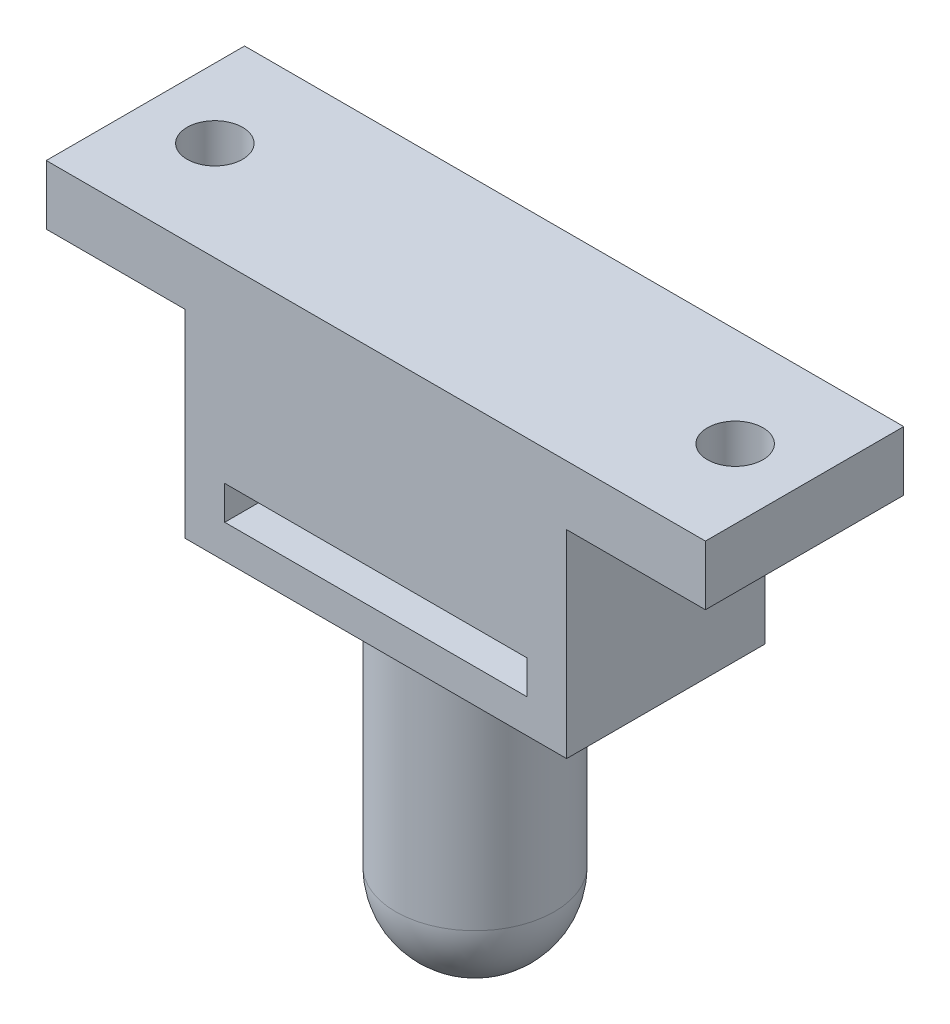
from build123d import *

# Parameters (mm, degrees)
SKETCH1_W             = 7
SKETCH1_H             = 10
BOSS_EXTRUDE1_DEPTH   = 3
BOSS_EXTRUDE1_2_DEPTH = 3
SKETCH1_4_W           = 19.24
SKETCH1_4_H           = 10
BOSS_EXTRUDE2_DEPTH   = 13
SKETCH2_W             = 15.24
SKETCH2_H             = 1.7
CUT_EXTRUDE1_DEPTH    = 14
SKETCH3_R             = 4
BOSS_EXTRUDE3_DEPTH   = 16
FILLET1_R             = 4
CUT_EXTRUDE2_REACH    = 35.797
SKETCH4_R             = 1.4
CUT_EXTRUDE3_REACH    = 37.797
CUT_EXTRUDE3_START    = -2
SKETCH4_3_R           = 1.4


with BuildPart() as part:
    # Sketch1 → Boss-Extrude1 (new body)
    with BuildSketch(Plane(origin=(0, 0, 0), x_dir=(1, 0, 0), z_dir=(0, 1, 0))):
        with Locations((-13.12, 0)):
            Rectangle(SKETCH1_W, SKETCH1_H)
    extrude(amount=-BOSS_EXTRUDE1_DEPTH)



with BuildPart() as body_2:
    # Sketch1 → Boss-Extrude1 2 (new body)
    with BuildSketch(Plane(origin=(0, 0, 0), x_dir=(1, 0, 0), z_dir=(0, 1, 0))):
        with Locations((13.12, 0)):
            Rectangle(SKETCH1_W, SKETCH1_H)
    extrude(amount=-BOSS_EXTRUDE1_2_DEPTH)


with BuildPart() as part_1:
    add(part.part)

    add(body_2.part)  # Boss-Extrude2 merges body 2
    # Sketch1<4> → Boss-Extrude2 (add)
    with BuildSketch(Plane(origin=(0, 0, 0), x_dir=(1, 0, 0), z_dir=(0, 1, 0))):
        Rectangle(SKETCH1_4_W, SKETCH1_4_H)
    extrude(amount=-BOSS_EXTRUDE2_DEPTH)

    # Sketch2 → Cut-Extrude1 (cut)
    with BuildSketch(Plane.XY.offset(5)):
        with Locations((0, -10.45)):
            Rectangle(SKETCH2_W, SKETCH2_H)
    extrude(amount=-CUT_EXTRUDE1_DEPTH, mode=Mode.SUBTRACT)

    # Sketch3 → Boss-Extrude3 (add)
    with BuildSketch(Plane.XZ.offset(13)):
        Circle(SKETCH3_R)
    extrude(amount=BOSS_EXTRUDE3_DEPTH)

    # Fillet1
    fillet1_edges = [part_1.edges().sort_by_distance(p)[0] for p in [
        (-4, -29, 0),
    ]]
    fillet(fillet1_edges, radius=FILLET1_R)

    # Sketch4 → Cut-Extrude2 (cut, up to next)
    with BuildSketch(Plane(origin=(0, 0, 0), x_dir=(1, 0, 0), z_dir=(0, 1, 0)), mode=Mode.PRIVATE) as cut_extrude2_sk1:
        with Locations((-13.12, 0)):
            Circle(SKETCH4_R)
    cut_extrude2_tool1 = extrude(cut_extrude2_sk1.sketch, amount=-CUT_EXTRUDE2_REACH, mode=Mode.PRIVATE) & part_1.part
    # Sketch4 → Cut-Extrude2 (cut, up to next)
    with BuildSketch(Plane(origin=(0, 0, 0), x_dir=(1, 0, 0), z_dir=(0, 1, 0)), mode=Mode.PRIVATE) as cut_extrude2_sk2:
        with Locations((13.12, 0)):
            Circle(SKETCH4_R)
    cut_extrude2_tool2 = extrude(cut_extrude2_sk2.sketch, amount=-CUT_EXTRUDE2_REACH, mode=Mode.PRIVATE) & part_1.part
    add(cut_extrude2_tool1.solids().sort_by_distance((-13.12, 0, 0))[0], mode=Mode.SUBTRACT)
    add(cut_extrude2_tool2.solids().sort_by_distance((13.12, 0, 0))[0], mode=Mode.SUBTRACT)

    # Sketch4<3> → Cut-Extrude3 (cut, up to next)
    with BuildSketch(Plane(origin=(0, 0, 0), x_dir=(1, 0, 0), z_dir=(0, 1, 0)).offset(CUT_EXTRUDE3_START), mode=Mode.PRIVATE) as cut_extrude3_sk1:
        Polygon((-15.62, 1.443375673), (-15.62, -1.443375673), (-13.12, -2.886751346), (-10.62, -1.443375673), (-10.62, 1.443375673), (-13.12, 2.886751346), align=None)
        with Locations((-13.12, 0)):
            Circle(SKETCH4_3_R, mode=Mode.SUBTRACT)
    cut_extrude3_tool1 = extrude(cut_extrude3_sk1.sketch, amount=-CUT_EXTRUDE3_REACH, mode=Mode.PRIVATE) & part_1.part
    # Sketch4<3> → Cut-Extrude3 (cut, up to next)
    with BuildSketch(Plane(origin=(0, 0, 0), x_dir=(1, 0, 0), z_dir=(0, 1, 0)).offset(CUT_EXTRUDE3_START), mode=Mode.PRIVATE) as cut_extrude3_sk2:
        Polygon((10.62, 1.443375673), (10.62, -1.443375673), (13.12, -2.886751346), (15.62, -1.443375673), (15.62, 1.443375673), (13.12, 2.886751346), align=None)
        with Locations((13.12, 0)):
            Circle(SKETCH4_3_R, mode=Mode.SUBTRACT)
    cut_extrude3_tool2 = extrude(cut_extrude3_sk2.sketch, amount=-CUT_EXTRUDE3_REACH, mode=Mode.PRIVATE) & part_1.part
    add(cut_extrude3_tool1.solids().sort_by_distance((-15.543624, -2, 0))[0], mode=Mode.SUBTRACT)
    add(cut_extrude3_tool2.solids().sort_by_distance((10.696376, -2, 0))[0], mode=Mode.SUBTRACT)


solid = part_1.part
